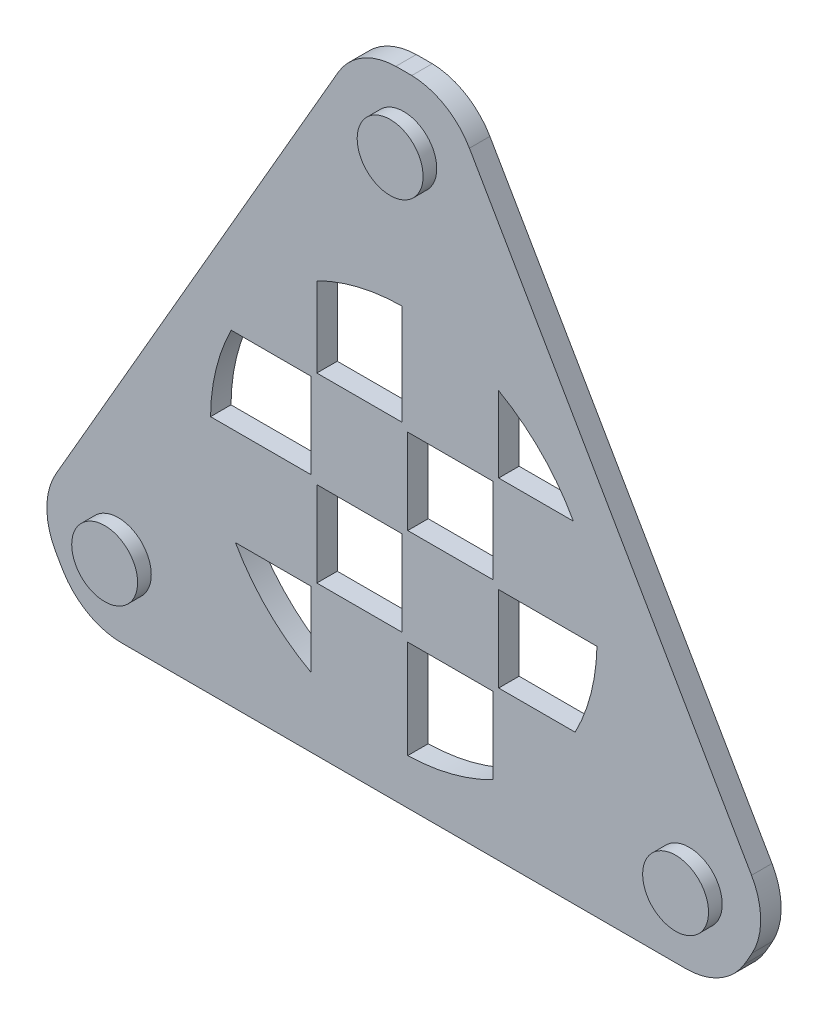
from build123d import *

# Parameters (mm, degrees)
SKETCH2_R               = 18
SKETCH2_W               = 7.5
SKETCH2_H               = 7.5
BOSS_EXTRUDE1_DEPTH     = 1.8
BOSS_EXTRUDE10_START    = 1.8
SKETCH18_W              = 7.7
SKETCH18_H              = 7.7
BOSS_EXTRUDE10_DEPTH    = 1.8
BOSS_EXTRUDE2_START     = -1.8
SKETCH3_R               = 35
SKETCH3_R_2             = 18
BOSS_EXTRUDE2_DEPTH     = 1.8
SKETCH4_R               = 2.9
BOSS_EXTRUDE3_DEPTH     = 3
CUT_EXTRUDE1_DEPTH      = 50.588305073
CUT_EXTRUDE1_DEPTH_BACK = 50.588305073
SKETCH7_R               = 59.131365533
FILLET1_R               = 6


with BuildPart() as part:
    # Sketch2 → Boss-Extrude1 (new body)
    with BuildSketch(Plane.XY.offset(10)):
        Circle(SKETCH2_R)
        with BuildLine():
            Line((-8.15, -8.35), (-8.15, -14.91903147))
            ThreePointArc((-8.15, -14.91903147), (-11.939670478, -12.101415986), (-14.808021475, -8.35))
            Line((-14.808021475, -8.35), (-8.15, -8.35))
        make_face(mode=Mode.SUBTRACT)
        with BuildLine():
            Line((-8.15, -7.85), (-15.079041747, -7.85))
            ThreePointArc((-15.079041747, -7.85), (-16.470304718, -4.210589327), (-16.996396677, -0.35))
            Line((-16.996396677, -0.35), (-8.15, -0.35))
            Line((-8.15, -0.35), (-8.15, -7.85))
        make_face(mode=Mode.SUBTRACT)
        with BuildLine():
            Line((-8.15, 0.15), (-16.999338222, 0.15))
            ThreePointArc((-16.999338222, 0.15), (-16.521617742, 4.00451585), (-15.181485435, 7.65))
            Line((-15.181485435, 7.65), (-8.15, 7.65))
            Line((-8.15, 7.65), (-8.15, 0.15))
        make_face(mode=Mode.SUBTRACT)
        with BuildLine():
            Line((-8.15, 8.15), (-14.91903147, 8.15))
            ThreePointArc((-14.91903147, 8.15), (-12.02081528, 12.02081528), (-8.15, 14.91903147))
            Line((-8.15, 14.91903147), (-8.15, 8.15))
        make_face(mode=Mode.SUBTRACT)
        with BuildLine():
            Line((-7.65, 8.15), (-7.65, 15.181485435))
            ThreePointArc((-7.65, 15.181485435), (-4.00451585, 16.521617742), (-0.15, 16.999338222))
            Line((-0.15, 16.999338222), (-0.15, 8.15))
            Line((-0.15, 8.15), (-7.65, 8.15))
        make_face(mode=Mode.SUBTRACT)
        with BuildLine():
            Line((0.35, 8.15), (0.35, 16.996396677))
            ThreePointArc((0.35, 16.996396677), (4.210589327, 16.470304718), (7.85, 15.079041747))
            Line((7.85, 15.079041747), (7.85, 8.15))
            Line((7.85, 8.15), (0.35, 8.15))
        make_face(mode=Mode.SUBTRACT)
        with BuildLine():
            Line((8.35, 8.15), (8.35, 14.808021475))
            ThreePointArc((8.35, 14.808021475), (12.101415986, 11.939670478), (14.91903147, 8.15))
            Line((14.91903147, 8.15), (8.35, 8.15))
        make_face(mode=Mode.SUBTRACT)
        with BuildLine():
            Line((8.35, 7.65), (15.181485435, 7.65))
            ThreePointArc((15.181485435, 7.65), (16.521617742, 4.00451585), (16.999338222, 0.15))
            Line((16.999338222, 0.15), (8.35, 0.15))
            Line((8.35, 0.15), (8.35, 7.65))
        make_face(mode=Mode.SUBTRACT)
        with BuildLine():
            Line((8.35, -0.35), (16.996396677, -0.35))
            ThreePointArc((16.996396677, -0.35), (16.470304718, -4.210589327), (15.079041747, -7.85))
            Line((15.079041747, -7.85), (8.35, -7.85))
            Line((8.35, -7.85), (8.35, -0.35))
        make_face(mode=Mode.SUBTRACT)
        with BuildLine():
            Line((8.35, -8.35), (14.808021475, -8.35))
            ThreePointArc((14.808021475, -8.35), (12.02081528, -12.02081528), (8.35, -14.808021475))
            Line((8.35, -14.808021475), (8.35, -8.35))
        make_face(mode=Mode.SUBTRACT)
        with BuildLine():
            Line((7.85, -8.35), (7.85, -15.079041747))
            ThreePointArc((7.85, -15.079041747), (4.210589327, -16.470304718), (0.35, -16.996396677))
            Line((0.35, -16.996396677), (0.35, -8.35))
            Line((0.35, -8.35), (7.85, -8.35))
        make_face(mode=Mode.SUBTRACT)
        with BuildLine():
            Line((-0.15, -8.35), (-0.15, -16.999338222))
            ThreePointArc((-0.15, -16.999338222), (-4.00451585, -16.521617742), (-7.65, -15.181485435))
            Line((-7.65, -15.181485435), (-7.65, -8.35))
            Line((-7.65, -8.35), (-0.15, -8.35))
        make_face(mode=Mode.SUBTRACT)
        with Locations((-3.9, -4.1)):
            Rectangle(SKETCH2_W, SKETCH2_H, mode=Mode.SUBTRACT)
        with Locations((4.1, -4.1)):
            Rectangle(SKETCH2_W, SKETCH2_H, mode=Mode.SUBTRACT)
        with Locations((-3.9, 3.9)):
            Rectangle(SKETCH2_W, SKETCH2_H, mode=Mode.SUBTRACT)
        with Locations((4.1, 3.9)):
            Rectangle(SKETCH2_W, SKETCH2_H, mode=Mode.SUBTRACT)
    extrude(amount=-BOSS_EXTRUDE1_DEPTH)

    # Sketch18 → Boss-Extrude10 (add)
    with BuildSketch(Plane.XY.offset(8.2).offset(BOSS_EXTRUDE10_START)):
        with BuildLine():
            ThreePointArc((7.85, 15.079041747), (4.11362184, 16.494790552), (0.15, 16.999338222))
            Line((0.15, 16.999338222), (0.15, 8.15))
            Line((0.15, 8.15), (7.85, 8.15))
            Line((7.85, 8.15), (7.85, 15.079041747))
        make_face()
        with BuildLine():
            Line((8.15, 0.15), (16.999338222, 0.15))
            ThreePointArc((16.999338222, 0.15), (16.494790552, 4.11362184), (15.079041747, 7.85))
            Line((15.079041747, 7.85), (8.15, 7.85))
            Line((8.15, 7.85), (8.15, 0.15))
        make_face()
        with Locations((-4, 4)):
            Rectangle(SKETCH18_W, SKETCH18_H)
        with Locations((4, -4)):
            Rectangle(SKETCH18_W, SKETCH18_H)
        with BuildLine():
            Line((8.15, -8.15), (8.15, -14.91903147))
            ThreePointArc((8.15, -14.91903147), (12.02081528, -12.02081528), (14.91903147, -8.15))
            Line((14.91903147, -8.15), (8.15, -8.15))
        make_face()
        with BuildLine():
            Line((-7.85, -8.15), (-7.85, -15.079041747))
            ThreePointArc((-7.85, -15.079041747), (-4.11362184, -16.494790552), (-0.15, -16.999338222))
            Line((-0.15, -16.999338222), (-0.15, -8.15))
            Line((-0.15, -8.15), (-7.85, -8.15))
        make_face()
        with BuildLine():
            ThreePointArc((-16.999338222, -0.15), (-16.494790552, -4.11362184), (-15.079041747, -7.85))
            Line((-15.079041747, -7.85), (-8.15, -7.85))
            Line((-8.15, -7.85), (-8.15, -0.15))
            Line((-8.15, -0.15), (-16.999338222, -0.15))
        make_face()
        with BuildLine():
            ThreePointArc((-8.15, 14.91903147), (-12.02081528, 12.02081528), (-14.91903147, 8.15))
            Line((-14.91903147, 8.15), (-8.15, 8.15))
            Line((-8.15, 8.15), (-8.15, 14.91903147))
        make_face()
    extrude(amount=-BOSS_EXTRUDE10_DEPTH)

    # Sketch3 → Boss-Extrude2 (add)
    with BuildSketch(Plane(origin=(0, 0, 8.2), x_dir=(-1, 0, 0), z_dir=(0, 0, -1)).offset(BOSS_EXTRUDE2_START)):
        Circle(SKETCH3_R)
        Circle(SKETCH3_R_2, mode=Mode.SUBTRACT)
    extrude(amount=BOSS_EXTRUDE2_DEPTH)

    # Sketch4 → Boss-Extrude3 (add)
    with BuildSketch(Plane(origin=(0, 0, 8.2), x_dir=(-1, 0, 0), z_dir=(0, 0, -1))):
        with Locations((0, 29)):
            Circle(SKETCH4_R)
        with Locations((25.11473671, -14.5)):
            Circle(SKETCH4_R)
        with Locations((-25.11473671, -14.5)):
            Circle(SKETCH4_R)
    extrude(amount=-BOSS_EXTRUDE3_DEPTH)

    # Sketch7 → Cut-Extrude1 (cut, two sides: drawn at the far end of the back side and taken through both)
    with BuildSketch(Plane(origin=(0, 0, 8.2), x_dir=(-1, 0, 0), z_dir=(0, 0, -1)).offset(-CUT_EXTRUDE1_DEPTH_BACK)):
        Circle(SKETCH7_R)
        Polygon((0, 42), (-36.373066959, -21), (36.373066959, -21), align=None, mode=Mode.SUBTRACT)
    extrude(amount=CUT_EXTRUDE1_DEPTH + CUT_EXTRUDE1_DEPTH_BACK, mode=Mode.SUBTRACT)

    # Fillet1
    fillet1_edges = [part.edges().sort_by_distance(p)[0] for p in [
        (4.186533479, 34.748711306, 9.1),
        (32.186533479, -13.748711306, 9.1),
        (28, -21, 9.1),
        (-28, -21, 9.1),
        (-32.186533479, -13.748711306, 9.1),
        (-4.186533479, 34.748711306, 9.1),
    ]]
    fillet(fillet1_edges, radius=FILLET1_R)


solid = part.part
